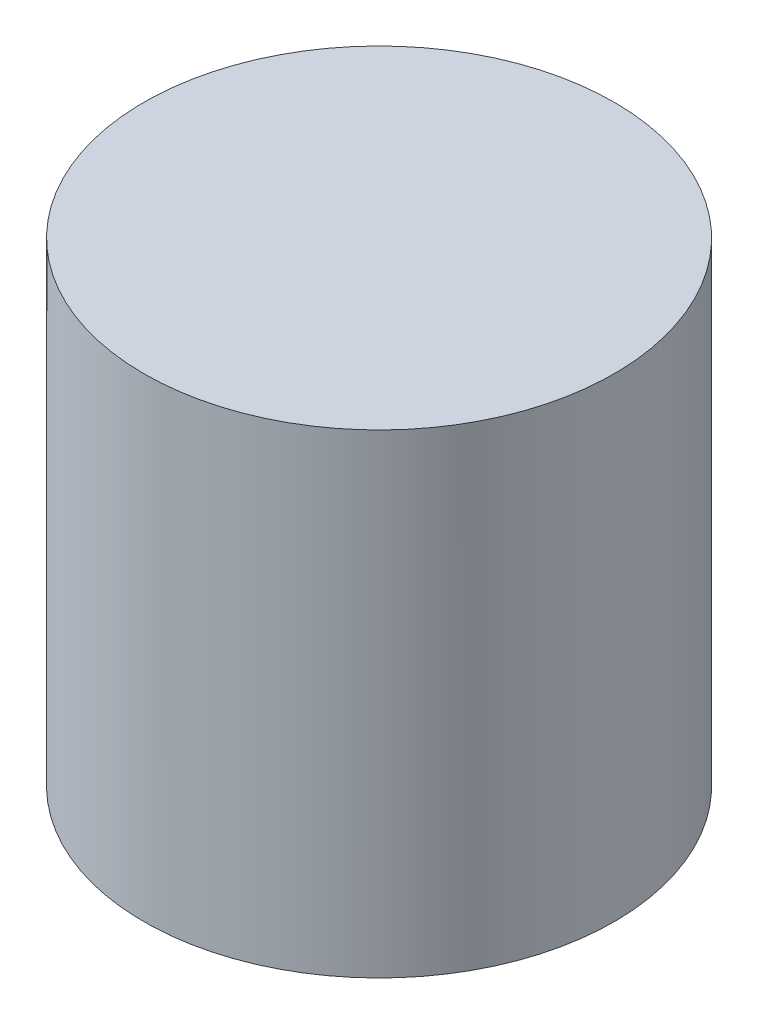
from build123d import *
from build123d.topology import SkipClean

# Parameters (mm, degrees)
SKETCH2_R               = 21.8
BOSS_EXTRUDE1_DEPTH     = 41
BOSS_EXTRUDE2_DEPTH     = 41
CUT_EXTRUDE1_REACH      = 65.696
CUT_EXTRUDE1_END_RADIUS = 17.5
CUT_EXTRUDE2_START      = -2
CUT_EXTRUDE2_DEPTH      = 3.460986
SKETCH6_R               = 21.8
BOSS_EXTRUDE3_DEPTH     = 3


with BuildPart() as part:
    # Sketch2 → Boss-Extrude1 (new body)
    with BuildSketch(Plane(origin=(0, 0, 0), x_dir=(1, 0, 0), z_dir=(0, 1, 0))):
        with Locations(Location((0, 0, 0), (0, 0, 270))):
            Circle(SKETCH2_R)
        with BuildLine():
            Line((-1.626404494, -19.231349626), (-1.5, -17.736685147))
            ThreePointArc((-1.5, -17.736685147), (0, -17.8), (1.5, -17.736685147))
            Line((1.5, -17.736685147), (1.626404494, -19.231349626))
            ThreePointArc((1.626404494, -19.231349626), (12.767961734, -14.473049201), (18.878439522, -4.011797753))
            Line((18.878439522, -4.011797753), (17.41120329, -3.7))
            ThreePointArc((17.41120329, -3.7), (17.615608663, -2.555451317), (17.74485841, -1.4))
            Line((17.74485841, -1.4), (20.037733373, -1.580898876))
            ThreePointArc((20.037733373, -1.580898876), (20.1, 0), (20.037733373, 1.580898876))
            Line((20.037733373, 1.580898876), (17.74485841, 1.4))
            ThreePointArc((17.74485841, 1.4), (17.615608663, 2.555451317), (17.41120329, 3.7))
            Line((17.41120329, 3.7), (18.878439522, 4.011797753))
            ThreePointArc((18.878439522, 4.011797753), (0, 19.3), (-18.878439522, 4.011797753))
            Line((-18.878439522, 4.011797753), (-17.41120329, 3.7))
            ThreePointArc((-17.41120329, 3.7), (-17.615608663, 2.555451317), (-17.74485841, 1.4))
            Line((-17.74485841, 1.4), (-20.037733373, 1.580898876))
            ThreePointArc((-20.037733373, 1.580898876), (-20.1, 0), (-20.037733373, -1.580898876))
            Line((-20.037733373, -1.580898876), (-17.74485841, -1.4))
            ThreePointArc((-17.74485841, -1.4), (-17.615608663, -2.555451317), (-17.41120329, -3.7))
            Line((-17.41120329, -3.7), (-18.878439522, -4.011797753))
            ThreePointArc((-18.878439522, -4.011797753), (-12.767961734, -14.473049201), (-1.626404494, -19.231349626))
        make_face(mode=Mode.SUBTRACT)
    extrude(amount=BOSS_EXTRUDE1_DEPTH)

    # Sketch3 → Boss-Extrude2 (add)
    with SkipClean():  # the faces are left unmerged after this step: merging them gives an invalid solid
        with BuildSketch(Plane.XZ):
            with BuildLine():
                Line((11, -18.82126457), (11, -13.610657589))
                ThreePointArc((11, -13.610657589), (0, -17.5), (-11, -13.610657589))
                Line((-11, -13.610657589), (-11, -18.82126457))
                ThreePointArc((-11, -18.82126457), (0, -21.8), (11, -18.82126457))
            make_face()
        extrude(amount=-BOSS_EXTRUDE2_DEPTH)

    # Cut-Extrude1: up to this cylinder (the profile starts outside it)
    with SkipClean():  # the faces are left unmerged after this step: merging them gives an invalid solid
        cut_extrude1_end = Plane(origin=(0, 4.031925, 0), z_dir=(0, -1, 0)) * Cylinder(CUT_EXTRUDE1_END_RADIUS, 167.392, mode=Mode.PRIVATE)
        # Sketch4 → Cut-Extrude1 (cut, up to the surface)
        with BuildSketch(Plane(origin=(0, 0, -21.8), x_dir=(-1, 0, 0), z_dir=(0, 0, -1)), mode=Mode.PRIVATE) as cut_extrude1_sk1:
            with BuildLine():
                Line((-9.5, 0), (9.5, 0))
                ThreePointArc((9.5, 0), (0, 9.5), (-9.5, 0))
            make_face()
        cut_extrude1_tool1 = extrude(cut_extrude1_sk1.sketch, amount=-CUT_EXTRUDE1_REACH, mode=Mode.PRIVATE) - cut_extrude1_end
        add(cut_extrude1_tool1.solids().sort_by_distance((0, 4.031925, -21.8))[0], mode=Mode.SUBTRACT)

    # Sketch5 → Cut-Extrude2 (cut)
    with SkipClean():  # the faces are left unmerged after this step: merging them gives an invalid solid
        with BuildSketch(Plane.XY.offset(-17.5).offset(CUT_EXTRUDE2_START)):
            with BuildLine():
                ThreePointArc((-7, 20.3), (0, 13.3), (7, 20.3))
                Line((7, 20.3), (7, 29.3))
                Line((7, 29.3), (-7, 29.3))
                Line((-7, 29.3), (-7, 20.3))
            make_face()
        extrude(amount=CUT_EXTRUDE2_DEPTH, mode=Mode.SUBTRACT)

    # Sketch6 → Boss-Extrude3 (add)
    with SkipClean():  # the faces are left unmerged after this step: merging them gives an invalid solid
        with BuildSketch(Plane(origin=(0, 41, 0), x_dir=(1, 0, 0), z_dir=(0, 1, 0))):
            with Locations(Location((0, 0, 0), (0, 0, 64.165074802))):
                Circle(SKETCH6_R)
        extrude(amount=BOSS_EXTRUDE3_DEPTH)


solid = part.part
